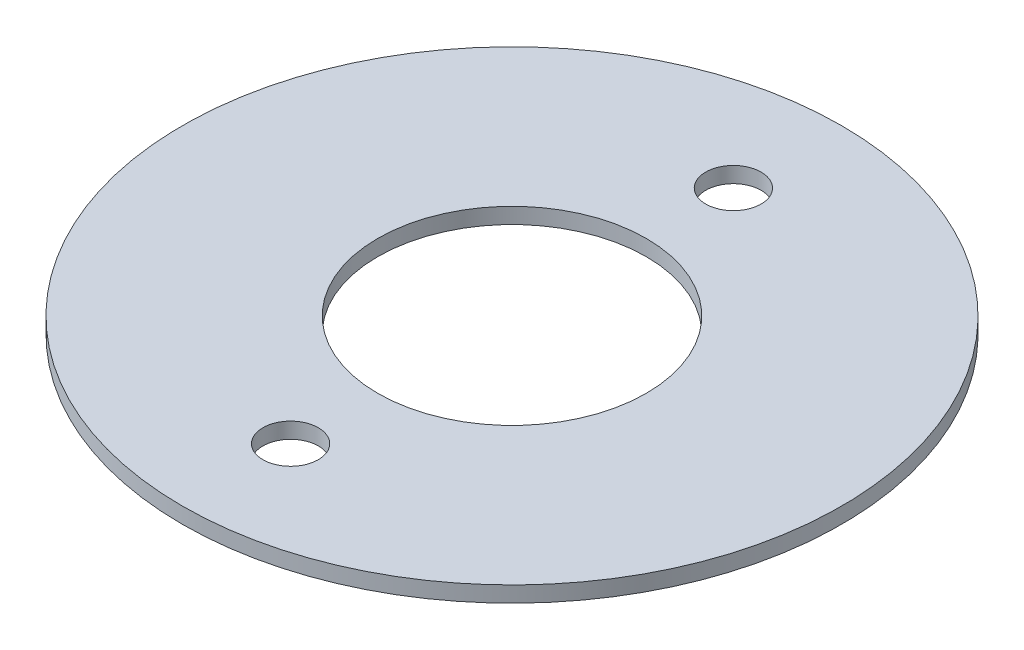
from build123d import *

# Parameters (mm, degrees)
SKETCH1_R           = 66.167
BOSS_EXTRUDE1_DEPTH = 3.175
SKETCH2_R           = 5.5626
SKETCH2_R_2         = 26.9494
CUT_EXTRUDE1_DEPTH  = 94.628117588


with BuildPart() as part:
    # Sketch1 → Boss-Extrude1 (new body)
    with BuildSketch(Plane(origin=(0, 0, 0), x_dir=(1, 0, 0), z_dir=(0, 1, 0))):
        with Locations(Location((0, 0, 0), (0, 0, 270))):
            Circle(SKETCH1_R)
    extrude(amount=BOSS_EXTRUDE1_DEPTH)

    # Sketch2 → Cut-Extrude1 (cut, through all)
    with BuildSketch(Plane.XZ):
        with Locations(Location((0, -44.45, 0), (0, 0, 270))):
            Circle(SKETCH2_R)
        with Locations(Location((0, 0, 0), (0, 0, 270))):
            Circle(SKETCH2_R_2)
        with Locations(Location((0, 44.45, 0), (0, 0, 270))):
            Circle(SKETCH2_R)
    extrude(amount=-CUT_EXTRUDE1_DEPTH, mode=Mode.SUBTRACT)


solid = part.part
